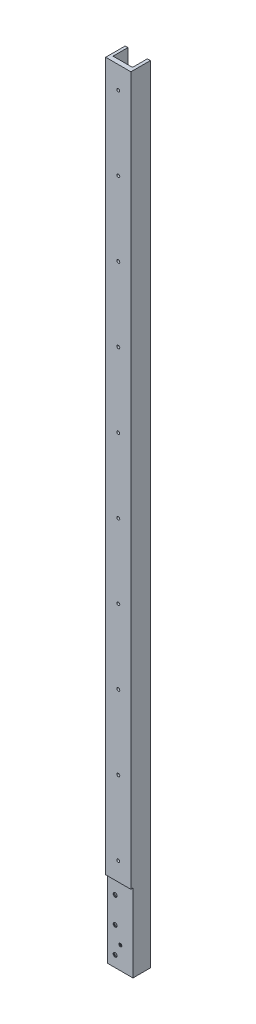
from build123d import *

# Parameters (mm, degrees)
SKETCH1_W                                        = 43.18
SKETCH1_H                                        = 1346.2
BOSS_EXTRUDE1_DEPTH                              = 33.3248
SKETCH9_W                                        = 33.3375
SKETCH9_H                                        = 33.121582444
CUT_EXTRUDE1_DEPTH                               = 1348.304529308
CSK_FOR_10_FLAT_HEAD_MACHINE_SCREW3_D            = 5.1054
CSK_FOR_10_FLAT_HEAD_MACHINE_SCREW3_DEPTH        = 76.2
CSK_FOR_10_FLAT_HEAD_MACHINE_SCREW3_CSINK_D      = 10.2206044
CSK_FOR_10_FLAT_HEAD_MACHINE_SCREW3_CSINK_ANGLE  = 82
CSK_FOR_10_FLAT_HEAD_MACHINE_SCREW3_TIP          = 1.533816902
SKETCH13_W                                       = 3.556
SKETCH13_H                                       = 133.35
CUT_EXTRUDE2_DEPTH                               = 1223.497433688
F_1_4_0_25_DIAMETER_HOLE1_D                      = 6.35
F_1_4_0_25_DIAMETER_HOLE1_DEPTH                  = 101.6
F_1_4_0_25_DIAMETER_HOLE1_TIP                    = 1.907732465
CSK_FOR_1_4_FLAT_HEAD_MACHINE_SCREW1_D           = 6.7564
CSK_FOR_1_4_FLAT_HEAD_MACHINE_SCREW1_CSINK_D     = 13.3194044
CSK_FOR_1_4_FLAT_HEAD_MACHINE_SCREW1_CSINK_ANGLE = 82


with BuildPart() as part:
    # Sketch1 → Boss-Extrude1 (new body)
    with BuildSketch(Plane.XY):
        with Locations((-21.59, -548.180033686)):
            Rectangle(SKETCH1_W, SKETCH1_H)
    extrude(amount=BOSS_EXTRUDE1_DEPTH)

    # Sketch9 → Cut-Extrude1 (cut, through all)
    with BuildSketch(Plane(origin=(0, 124.919966314, 0), x_dir=(1, 0, 0), z_dir=(0, 1, 0))):
        with Locations((-21.81225, -8.826508778)):
            Rectangle(SKETCH9_W, SKETCH9_H)
    extrude(amount=-CUT_EXTRUDE1_DEPTH, mode=Mode.SUBTRACT)

    # CSK for #10 Flat Head Machine Screw3
    with Locations(Plane(origin=(0, 0, 25.3873), x_dir=(-1, 0, 0), z_dir=(0, 0, -1))):
        with Locations((21.59, -1183.180033686), (21.59, -1056.180033686), (21.59, -929.180033686), (21.59, -802.180033686), (21.59, -675.180033686), (21.59, -548.180033686), (21.59, -421.180033686), (21.59, -294.180033686), (21.59, -167.180033686), (21.59, -40.180033686), (21.59, 86.819966314)):
            CounterSinkHole(CSK_FOR_10_FLAT_HEAD_MACHINE_SCREW3_D / 2, CSK_FOR_10_FLAT_HEAD_MACHINE_SCREW3_CSINK_D / 2, depth=CSK_FOR_10_FLAT_HEAD_MACHINE_SCREW3_DEPTH, counter_sink_angle=CSK_FOR_10_FLAT_HEAD_MACHINE_SCREW3_CSINK_ANGLE)
            with Locations((0, 0, -(CSK_FOR_10_FLAT_HEAD_MACHINE_SCREW3_DEPTH + CSK_FOR_10_FLAT_HEAD_MACHINE_SCREW3_TIP / 2))):  # 118° drill point
                Cone(0, CSK_FOR_10_FLAT_HEAD_MACHINE_SCREW3_D / 2, CSK_FOR_10_FLAT_HEAD_MACHINE_SCREW3_TIP, mode=Mode.SUBTRACT)

    # Sketch13 → Cut-Extrude2 (cut, through all)
    with BuildSketch(Plane(origin=(0, 0, 0), x_dir=(0, 0, -1), z_dir=(1, 0, 0))):
        with Locations((-31.5468, -1154.605033686)):
            Rectangle(SKETCH13_W, SKETCH13_H)
    extrude(amount=-CUT_EXTRUDE2_DEPTH, mode=Mode.SUBTRACT)

    # 1/4 (0.25) Diameter Hole1
    with Locations(Plane(origin=(239.606310056, -1806.580108517, 74.980799953), x_dir=(1.0, -1.0349876365418451e-08, -1.6518326251249117e-10), z_dir=(1.651832625124912e-10, 0, 1.0))):
        with Locations((-270.086317003, 693.250072448), (-231.986317003, 693.250072747), (-270.086316654, 648.800072448), (-231.986316654, 648.800072747), (-270.086316305, 604.350072448), (-231.986316305, 604.350072747)):
            Hole(F_1_4_0_25_DIAMETER_HOLE1_D / 2, depth=F_1_4_0_25_DIAMETER_HOLE1_DEPTH)
            with Locations((0, 0, -(F_1_4_0_25_DIAMETER_HOLE1_DEPTH + F_1_4_0_25_DIAMETER_HOLE1_TIP / 2))):  # 118° drill point
                Cone(0, F_1_4_0_25_DIAMETER_HOLE1_D / 2, F_1_4_0_25_DIAMETER_HOLE1_TIP, mode=Mode.SUBTRACT)

    # CSK for 1/4 Flat Head Machine Screw1 (through all)
    with Locations(Plane(origin=(0, 0, 25.3873), x_dir=(-1, 0, 0), z_dir=(0, 0, -1))):
        with Locations((30.47999989, -1157.780033273), (30.480000001, -1202.230033273), (30.479999779, -1113.330033273)):
            CounterSinkHole(CSK_FOR_1_4_FLAT_HEAD_MACHINE_SCREW1_D / 2, CSK_FOR_1_4_FLAT_HEAD_MACHINE_SCREW1_CSINK_D / 2, counter_sink_angle=CSK_FOR_1_4_FLAT_HEAD_MACHINE_SCREW1_CSINK_ANGLE)


solid = part.part
